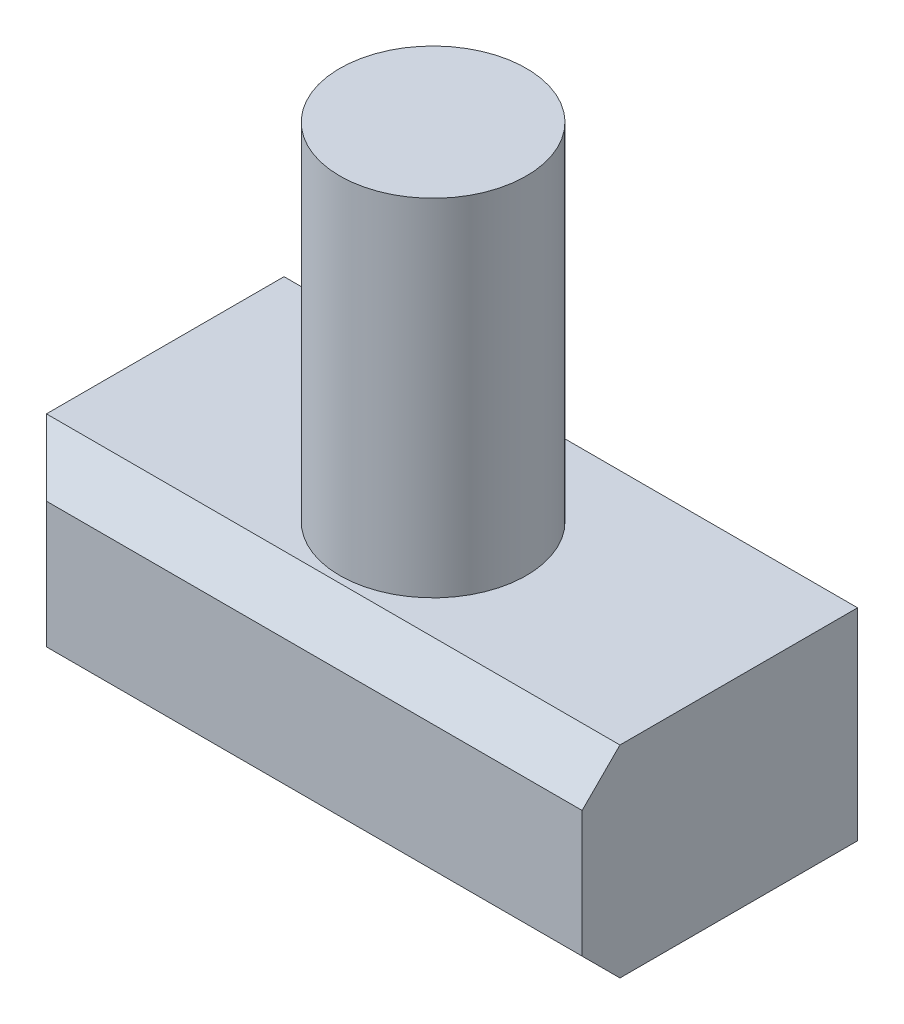
from build123d import *

# Parameters (mm, degrees)
SKETCH1_W           = 245.429281818
SKETCH1_H           = 117.865734126
BOSS_EXTRUDE1_DEPTH = 86.36
CHAMFER1_SIZE       = 16.18000066
SKETCH2_R           = 39.915781682
BOSS_EXTRUDE2_DEPTH = 148.082


with BuildPart() as part:
    # Sketch1 → Boss-Extrude1 (new body)
    with BuildSketch(Plane(origin=(0, 0, 0), x_dir=(1, 0, 0), z_dir=(0, 1, 0))):
        Rectangle(SKETCH1_W, SKETCH1_H)
    extrude(amount=BOSS_EXTRUDE1_DEPTH)

    # Chamfer1
    chamfer1_edges = [part.edges().sort_by_distance(p)[0] for p in [
        (0, 86.36, 58.932867063),
        (0, 0, 58.932867063),
        (-122.714640909, 43.18, 58.932867063),
    ]]
    chamfer(chamfer1_edges, length=CHAMFER1_SIZE)

    # Sketch2 → Boss-Extrude2 (add)
    with BuildSketch(Plane(origin=(0, 86.36, 0), x_dir=(1, 0, 0), z_dir=(0, 1, 0))):
        with Locations(Location((0, 0, 0), (0, 0, 270))):
            Circle(SKETCH2_R)
    extrude(amount=BOSS_EXTRUDE2_DEPTH)


solid = part.part
